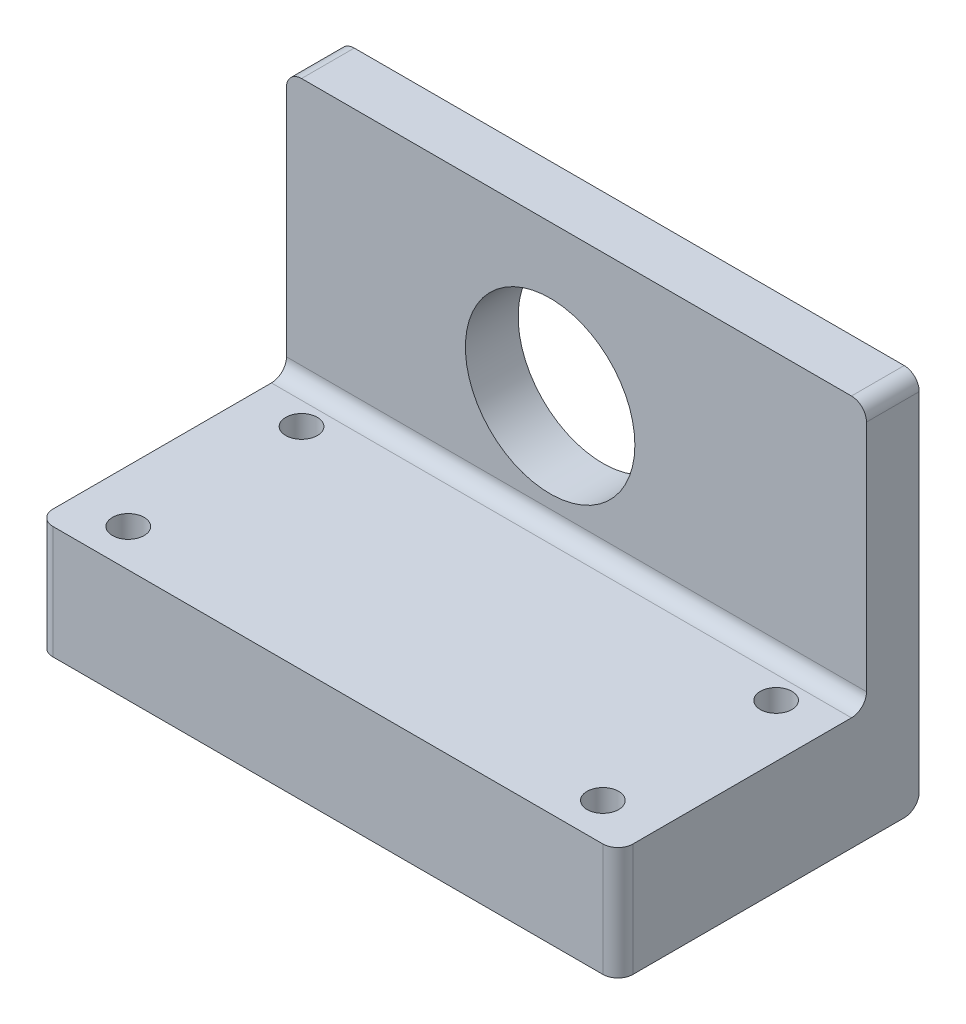
from build123d import *

# Parameters (mm, degrees)
SKETCH1_W           = 77
SKETCH1_H           = 35
BOSS_EXTRUDE1_DEPTH = 7
SKETCH2_R           = 11.25
CUT_EXTRUDE1_DEPTH  = 15
SKETCH3_W           = 77
SKETCH3_H           = 15
BOSS_EXTRUDE2_DEPTH = 40
SKETCH4_R           = 2.1
CUT_EXTRUDE2_DEPTH  = 20
FILLET1_R           = 2
FILLET2_R           = 2


with BuildPart() as part:
    # Sketch1 → Boss-Extrude1 (new body)
    with BuildSketch(Plane.XY):
        with Locations((3.5, 0)):
            Rectangle(SKETCH1_W, SKETCH1_H)
    extrude(amount=BOSS_EXTRUDE1_DEPTH)

    # Sketch2 → Cut-Extrude1 (cut)
    with BuildSketch(Plane.XY.offset(7)):
        with Locations((0, -2.5)):
            Circle(SKETCH2_R)
    extrude(amount=-CUT_EXTRUDE1_DEPTH, mode=Mode.SUBTRACT)

    # Sketch3 → Boss-Extrude2 (add)
    with BuildSketch(Plane(origin=(0, 0, 0), x_dir=(-1, 0, 0), z_dir=(0, 0, -1))):
        with Locations((-3.5, -25)):
            Rectangle(SKETCH3_W, SKETCH3_H)
    extrude(amount=-BOSS_EXTRUDE2_DEPTH)

    # Sketch4 → Cut-Extrude2 (cut)
    with BuildSketch(Plane(origin=(0, -17.5, 0), x_dir=(1, 0, 0), z_dir=(0, 1, 0))):
        with Locations(Location((-28, -35, 0), (0, 0, 180))):
            Circle(SKETCH4_R)
        with Locations(Location((-28, -12, 0), (0, 0, 180))):
            Circle(SKETCH4_R)
        with Locations(Location((35, -35, 0), (0, 0, 180))):
            Circle(SKETCH4_R)
        with Locations(Location((35, -12, 0), (0, 0, 180))):
            Circle(SKETCH4_R)
    extrude(amount=-CUT_EXTRUDE2_DEPTH, mode=Mode.SUBTRACT)

    # Fillet1
    fillet1_edges = [part.edges().sort_by_distance(p)[0] for p in [
        (3.5, -17.5, 7),
    ]]
    fillet(fillet1_edges, radius=FILLET1_R)

    # Fillet2
    fillet2_edges = [part.edges().sort_by_distance(p)[0] for p in [
        (42, -25, 40),
        (-35, -25, 40),
        (3.5, -32.5, 0),
        (-35, 17.5, 3.5),
        (42, 17.5, 3.5),
    ]]
    fillet(fillet2_edges, radius=FILLET2_R)


solid = part.part
